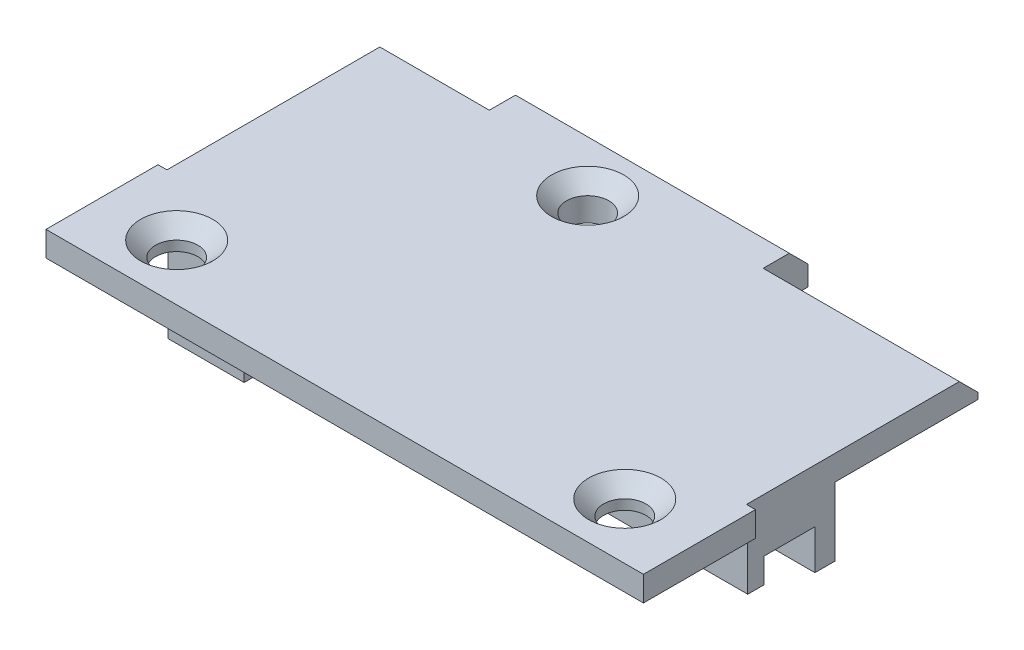
from build123d import *

# Parameters (mm, degrees)
SKETCH1_R           = 1.7
BOSS_EXTRUDE1_DEPTH = 2
CHAMFER1_SIZE       = 1.5
CHAMFER2_SIZE       = 1.2
SKETCH2_W           = 22
SKETCH2_H           = 1.7
BOSS_EXTRUDE2_DEPTH = 1.1
SKETCH3_W           = 14
SKETCH3_H           = 7
SKETCH3_R           = 1.7
BOSS_EXTRUDE3_DEPTH = 1.1
BOSS_EXTRUDE4_DEPTH = 5.5
FILLET1_R           = 0.5
SKETCH5_W           = 6.1
SKETCH5_H           = 5.4
BOSS_EXTRUDE5_DEPTH = 4.3
SKETCH6_W           = 40.46
SKETCH6_H           = 5.4
CUT_EXTRUDE1_DEPTH  = 1.2
CUT_EXTRUDE2_DEPTH  = 2
SKETCH8_W           = 14
SKETCH8_H           = 5
CUT_EXTRUDE3_DEPTH  = 1


with BuildPart() as part:
    # Sketch1 → Boss-Extrude1 (new body)
    with BuildSketch(Plane(origin=(0, 0, 0), x_dir=(1, 0, 0), z_dir=(0, 1, 0))):
        Polygon((0, 0), (0, 9), (0.72, 9), (0.72, 27.6), (9.52, 27.6), (9.52, 29.7), (31.52, 29.7), (31.52, 27.6), (47.28, 27.6), (47.28, 9), (48, 9), (48, 0), align=None)
        with Locations(Location((19.42, 24.1, 0), (0, 0, 270))):
            Circle(SKETCH1_R, mode=Mode.SUBTRACT)
        with Locations(Location((6, 4.5, 0), (0, 0, 270))):
            Circle(SKETCH1_R, mode=Mode.SUBTRACT)
        with Locations(Location((42, 4.5, 0), (0, 0, 270))):
            Circle(SKETCH1_R, mode=Mode.SUBTRACT)
    extrude(amount=-BOSS_EXTRUDE1_DEPTH)

    # Chamfer1
    chamfer1_edges = [part.edges().sort_by_distance(p)[0] for p in [
        (5.12, 0, -27.6),
        (20.52, 0, -29.7),
        (39.4, 0, -27.6),
    ]]
    chamfer(chamfer1_edges, length=CHAMFER1_SIZE)

    # Chamfer2
    chamfer2_edges = [part.edges().sort_by_distance(p)[0] for p in [
        (19.42, 0, -25.8),
        (6, 0, -6.2),
        (42, 0, -6.2),
    ]]
    chamfer(chamfer2_edges, length=CHAMFER2_SIZE)

    # Sketch2 → Boss-Extrude2 (add)
    with BuildSketch(Plane.XZ.offset(2)):
        with Locations((20.52, -28.85)):
            Rectangle(SKETCH2_W, SKETCH2_H)
    extrude(amount=BOSS_EXTRUDE2_DEPTH)

    # Sketch3 → Boss-Extrude3 (add)
    with BuildSketch(Plane.XZ.offset(2)):
        with Locations((19.42, -24.5)):
            Rectangle(SKETCH3_W, SKETCH3_H)
        with Locations(Location((19.42, -24.1, 0), (0, 0, 90))):
            Circle(SKETCH3_R, mode=Mode.SUBTRACT)
    extrude(amount=BOSS_EXTRUDE3_DEPTH)

    # Sketch4 → Boss-Extrude4 (add)
    with BuildSketch(Plane.XZ.offset(2)):
        Polygon((0.72, -9.1), (47.28, -9.1), (47.28, -16.1), (44.08, -16.1), (44.08, -16.3), (44.08, -18.2), (42.26, -18.2), (42.26, -16), (38.56, -16), (38.56, -18.2), (35.18, -18.2), (35.18, -16), (31.48, -16), (31.48, -18.2), (30.28, -18.2), (30.28, -14.4), (26.6, -14.4), (26.6, -13.4), (11.4, -13.4), (11.4, -18.2), (10.02, -18.2), (10.02, -16), (6.32, -16), (6.32, -18.2), (3.72, -18.2), (3.72, -19.4), (0.72, -19.4), align=None)
    extrude(amount=BOSS_EXTRUDE4_DEPTH)

    # Fillet1
    fillet1_edges = [part.edges().sort_by_distance(p)[0] for p in [
        (6.32, -4.75, -18.2),
        (6.32, -4.75, -16),
        (10.02, -4.75, -16),
        (10.02, -4.75, -18.2),
        (31.48, -4.75, -18.2),
        (31.48, -4.75, -16),
        (35.18, -4.75, -16),
        (35.18, -4.75, -18.2),
        (38.56, -4.75, -18.2),
        (38.56, -4.75, -16),
        (42.26, -4.75, -16),
        (42.26, -4.75, -18.2),
    ]]
    fillet(fillet1_edges, radius=FILLET1_R)

    # Sketch5 → Boss-Extrude5 (add)
    with BuildSketch(Plane.XZ.offset(7.5)):
        with Locations((3.77, -11.8)):
            Rectangle(SKETCH5_W, SKETCH5_H)
    extrude(amount=BOSS_EXTRUDE5_DEPTH)

    # Sketch6 → Cut-Extrude1 (cut)
    with BuildSketch(Plane.XZ.offset(7.5)):
        with Locations((27.05, -11.8)):
            Rectangle(SKETCH6_W, SKETCH6_H)
    extrude(amount=-CUT_EXTRUDE1_DEPTH, mode=Mode.SUBTRACT)

    # Sketch7 → Cut-Extrude2 (cut)
    with BuildSketch(Plane.XZ.offset(6.3)):
        with BuildLine():
            Line((11.4, -13.4), (11.4, -13.12))
            ThreePointArc((11.4, -13.12), (11.60493511, -12.509074208), (12.14, -12.15))
            Line((12.14, -12.15), (14.52, -11.489318534))
            ThreePointArc((14.52, -11.489318534), (19.044112004, -10.644197545), (23.64, -10.4))
            Line((23.64, -10.4), (47.28, -10.4))
            Line((47.28, -10.4), (47.28, -14.5))
            Line((47.28, -14.5), (26.6, -14.5))
            Line((26.6, -14.5), (26.6, -13.4))
            Line((26.6, -13.4), (11.4, -13.4))
        make_face()
    extrude(amount=-CUT_EXTRUDE2_DEPTH, mode=Mode.SUBTRACT)

    # Sketch8 → Cut-Extrude3 (cut)
    with BuildSketch(Plane.XZ.offset(2)):
        with Locations((19.42, -18.5)):
            Rectangle(SKETCH8_W, SKETCH8_H)
    extrude(amount=-CUT_EXTRUDE3_DEPTH, mode=Mode.SUBTRACT)


solid = part.part
